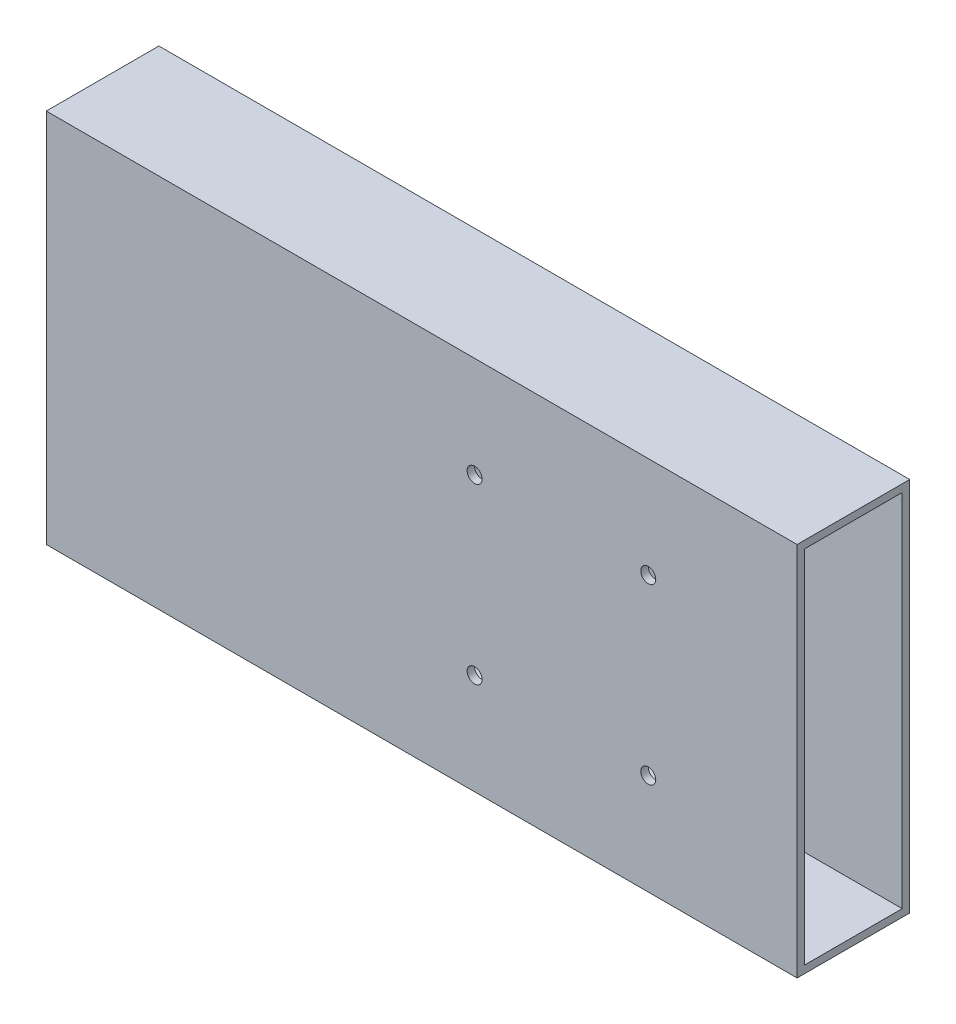
from build123d import *

# Parameters (mm, degrees)
IZIM1_W                     = 400
IZIM1_H                     = 200
Y_KSEKLIK_EKSTR_ZYON2_DEPTH = 60
BO_ALTMA2_T                 = -4
KES_EKSTR_ZYON2_REACH       = 453.221
IZIM3_R                     = 4


with BuildPart() as part:
    # Çizim1 → Yükseklik-Ekstrüzyon2 (new body)
    with BuildSketch(Plane.XY):
        with Locations((-200, 100)):
            Rectangle(IZIM1_W, IZIM1_H)
    extrude(amount=Y_KSEKLIK_EKSTR_ZYON2_DEPTH)

    # İç Boşaltma2
    bo_altma2_openings = [part.faces().sort_by_distance(p)[0] for p in [
        (-400, 100, 30),
        (0, 100, 30),
    ]]
    offset(amount=BO_ALTMA2_T, openings=bo_altma2_openings, kind=Kind.INTERSECTION)

    # Çizim3 → Kes-Ekstrüzyon2 (cut, up to next)
    with BuildSketch(Plane.XY.offset(60), mode=Mode.PRIVATE) as kes_ekstr_zyon2_sk1:
        with Locations((-79.297757223, 146.25)):
            Circle(IZIM3_R)
    kes_ekstr_zyon2_tool1 = extrude(kes_ekstr_zyon2_sk1.sketch, amount=-KES_EKSTR_ZYON2_REACH, mode=Mode.PRIVATE) & part.part
    # Çizim3 → Kes-Ekstrüzyon2 (cut, up to next)
    with BuildSketch(Plane.XY.offset(60), mode=Mode.PRIVATE) as kes_ekstr_zyon2_sk2:
        with Locations((-171.797757223, 146.25)):
            Circle(IZIM3_R)
    kes_ekstr_zyon2_tool2 = extrude(kes_ekstr_zyon2_sk2.sketch, amount=-KES_EKSTR_ZYON2_REACH, mode=Mode.PRIVATE) & part.part
    # Çizim3 → Kes-Ekstrüzyon2 (cut, up to next)
    with BuildSketch(Plane.XY.offset(60), mode=Mode.PRIVATE) as kes_ekstr_zyon2_sk3:
        with Locations((-79.297757223, 53.75)):
            Circle(IZIM3_R)
    kes_ekstr_zyon2_tool3 = extrude(kes_ekstr_zyon2_sk3.sketch, amount=-KES_EKSTR_ZYON2_REACH, mode=Mode.PRIVATE) & part.part
    # Çizim3 → Kes-Ekstrüzyon2 (cut, up to next)
    with BuildSketch(Plane.XY.offset(60), mode=Mode.PRIVATE) as kes_ekstr_zyon2_sk4:
        with Locations((-171.797757223, 53.75)):
            Circle(IZIM3_R)
    kes_ekstr_zyon2_tool4 = extrude(kes_ekstr_zyon2_sk4.sketch, amount=-KES_EKSTR_ZYON2_REACH, mode=Mode.PRIVATE) & part.part
    add(kes_ekstr_zyon2_tool1.solids().sort_by_distance((-79.297757, 146.25, 60))[0], mode=Mode.SUBTRACT)
    add(kes_ekstr_zyon2_tool2.solids().sort_by_distance((-171.797757, 146.25, 60))[0], mode=Mode.SUBTRACT)
    add(kes_ekstr_zyon2_tool3.solids().sort_by_distance((-79.297757, 53.75, 60))[0], mode=Mode.SUBTRACT)
    add(kes_ekstr_zyon2_tool4.solids().sort_by_distance((-171.797757, 53.75, 60))[0], mode=Mode.SUBTRACT)


solid = part.part
